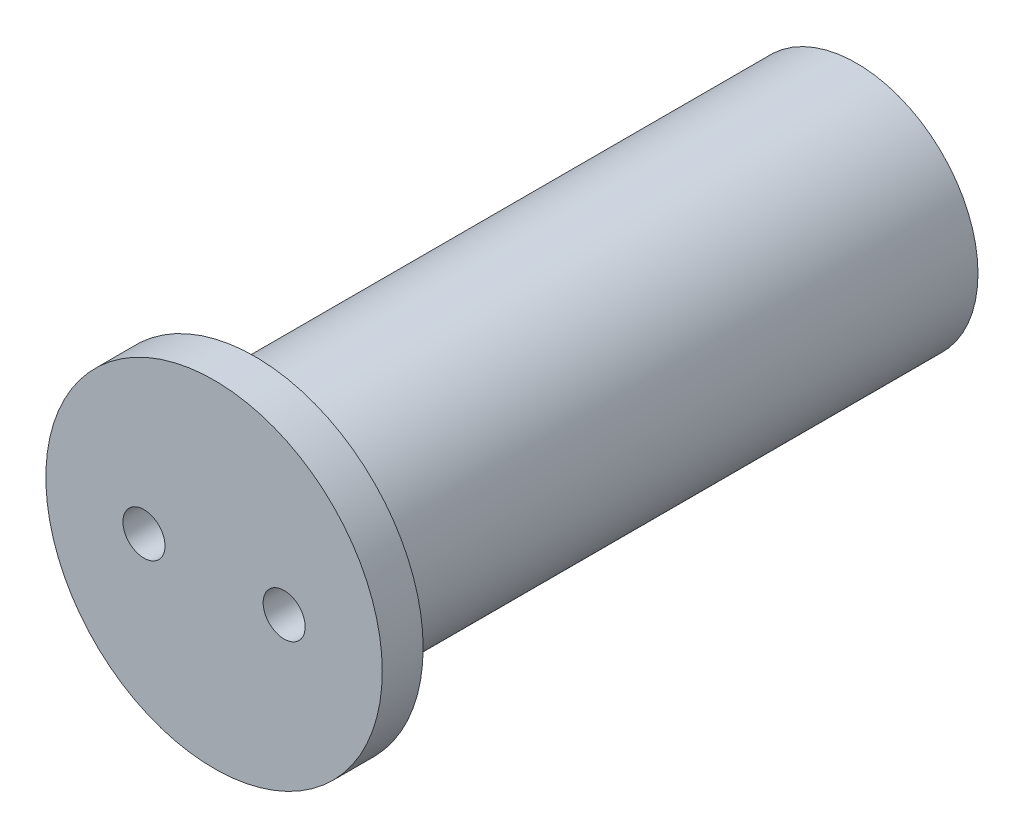
from build123d import *

# Parameters (mm, degrees)
SKETCH_1_R          = 5.2
EXTRUDE_1_DEPTH     = 27.5
SKETCH_6_R          = 7.2
EXTRUDE_3_DEPTH     = 1.75
SKETCH_3_R          = 0.85
CUT_EXTRUDE_4_DEPTH = 8
SKETCH_7_R          = 0.9
CUT_EXTRUDE_5_DEPTH = 8


with BuildPart() as part:
    # 草图1 → 凸台-拉伸1 (new body)
    with BuildSketch(Plane.XY):
        Circle(SKETCH_1_R)
    extrude(amount=EXTRUDE_1_DEPTH)

    # 草图6 → 凸台-拉伸3 (add)
    with BuildSketch(Plane.XY.offset(27.5)):
        Circle(SKETCH_6_R)
    extrude(amount=-EXTRUDE_3_DEPTH)

    # 草图3 → 切除-拉伸4 (cut)
    with BuildSketch(Plane.XY.offset(27.5)):
        with Locations((-3, 0)):
            Circle(SKETCH_3_R)
        with Locations((3, 0)):
            Circle(SKETCH_3_R)
    cut_extrude_4 = extrude(amount=-CUT_EXTRUDE_4_DEPTH, mode=Mode.SUBTRACT)

    # 镜向3: 切除-拉伸4 across plane
    add(cut_extrude_4.mirror(Plane.XY.offset(13.75)), mode=Mode.SUBTRACT)

    # 草图7 → 切除-拉伸5 (cut)
    with BuildSketch(Plane.XY.offset(27.5)):
        with Locations((-3, 0)):
            Circle(SKETCH_7_R)
        with Locations((3, 0)):
            Circle(SKETCH_7_R)
    extrude(amount=-CUT_EXTRUDE_5_DEPTH, mode=Mode.SUBTRACT)


solid = part.part
